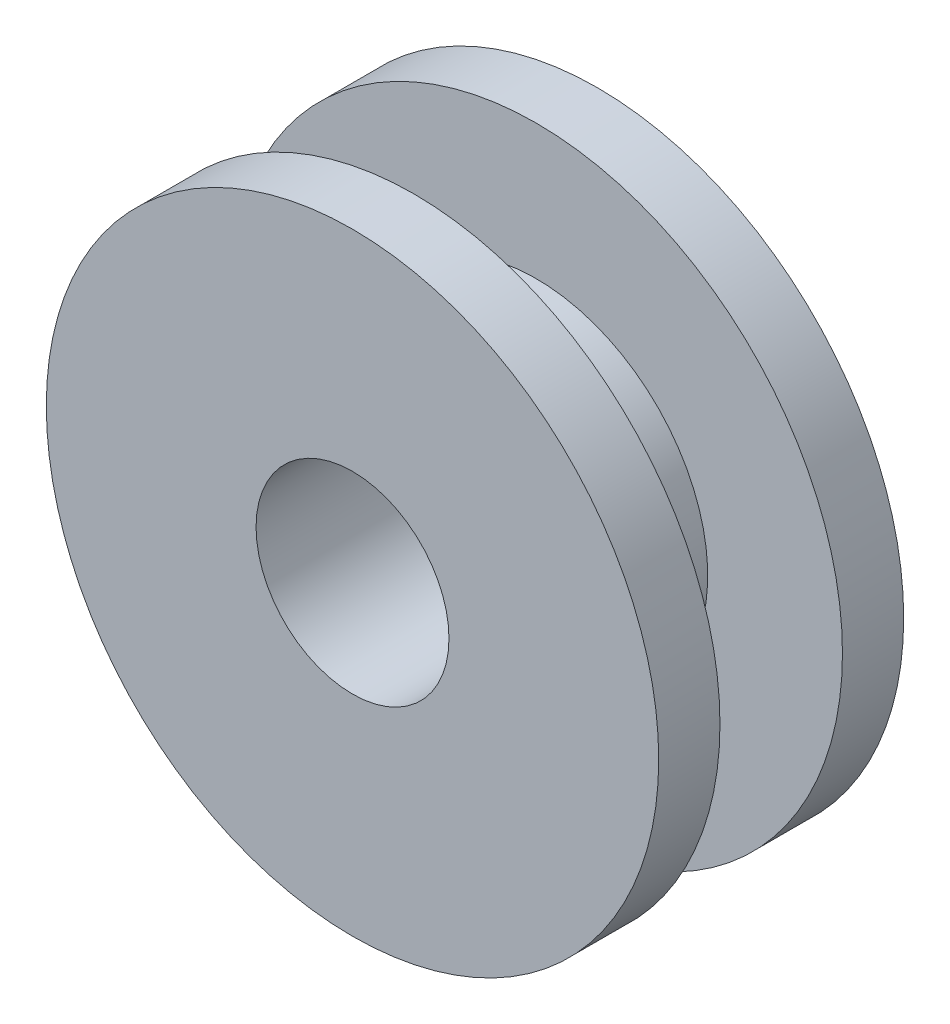
from build123d import *

# Parameters (mm, degrees)
BOSS_EXTRUDE1_DEPTH = 7
SKETCH2_R           = 1.35
CUT_EXTRUDE1_DEPTH  = 1.7
SKETCH3_R           = 10
BOSS_EXTRUDE2_DEPTH = 2
SKETCH4_R           = 5.6
BOSS_EXTRUDE3_DEPTH = 4
SKETCH5_R           = 10
BOSS_EXTRUDE4_DEPTH = 2
SKETCH6_R           = 3.15
CUT_EXTRUDE2_DEPTH  = 17.248076809
SKETCH7_R           = 17.649258726
CUT_EXTRUDE3_DEPTH  = 7


with BuildPart() as part:
    # Sketch1 → Boss-Extrude1 (new body)
    with BuildSketch(Plane.XY):
        with BuildLine():
            Line((-5, 0), (-5, -8))
            Line((-5, -8), (5, -8))
            Line((5, -8), (5, 0))
            ThreePointArc((5, 0), (0, 5), (-5, 0))
        make_face()
        with BuildLine():
            Line((-3.5, -6.3), (-3.5, -2.3))
            Line((-3.5, -2.3), (-1.926136028, -2.3))
            ThreePointArc((-1.926136028, -2.3), (-1.269171366, 2.718309041), (3, 0))
            ThreePointArc((3, 0), (2.718309041, -1.269171366), (1.926136028, -2.3))
            Line((1.926136028, -2.3), (3.5, -2.3))
            Line((3.5, -2.3), (3.5, -6.3))
            Line((3.5, -6.3), (-3.5, -6.3))
        make_face(mode=Mode.SUBTRACT)
    extrude(amount=BOSS_EXTRUDE1_DEPTH)

    # Sketch2 → Cut-Extrude1 (cut)
    with BuildSketch(Plane.XZ.offset(8)):
        with Locations(Location((0, 4, 0), (0, 0, 270))):
            Circle(SKETCH2_R)
    extrude(amount=-CUT_EXTRUDE1_DEPTH, mode=Mode.SUBTRACT)

    # Sketch3 → Boss-Extrude2 (add)
    with BuildSketch(Plane(origin=(0, 0, 0), x_dir=(-1, 0, 0), z_dir=(0, 0, -1))):
        Circle(SKETCH3_R)
    extrude(amount=BOSS_EXTRUDE2_DEPTH)

    # Sketch4 → Boss-Extrude3 (add)
    with BuildSketch(Plane(origin=(0, 0, -2), x_dir=(-1, 0, 0), z_dir=(0, 0, -1))):
        Circle(SKETCH4_R)
    extrude(amount=BOSS_EXTRUDE3_DEPTH)

    # Sketch5 → Boss-Extrude4 (add)
    with BuildSketch(Plane(origin=(0, 0, -6), x_dir=(-1, 0, 0), z_dir=(0, 0, -1))):
        Circle(SKETCH5_R)
    extrude(amount=BOSS_EXTRUDE4_DEPTH)

    # Sketch6 → Cut-Extrude2 (cut, through all)
    with BuildSketch(Plane.XY):
        Circle(SKETCH6_R)
    extrude(amount=-CUT_EXTRUDE2_DEPTH, mode=Mode.SUBTRACT)

    # Sketch7 → Cut-Extrude3 (cut)
    with BuildSketch(Plane.XY.offset(7)):
        Circle(SKETCH7_R)
    extrude(amount=-CUT_EXTRUDE3_DEPTH, mode=Mode.SUBTRACT)


solid = part.part
